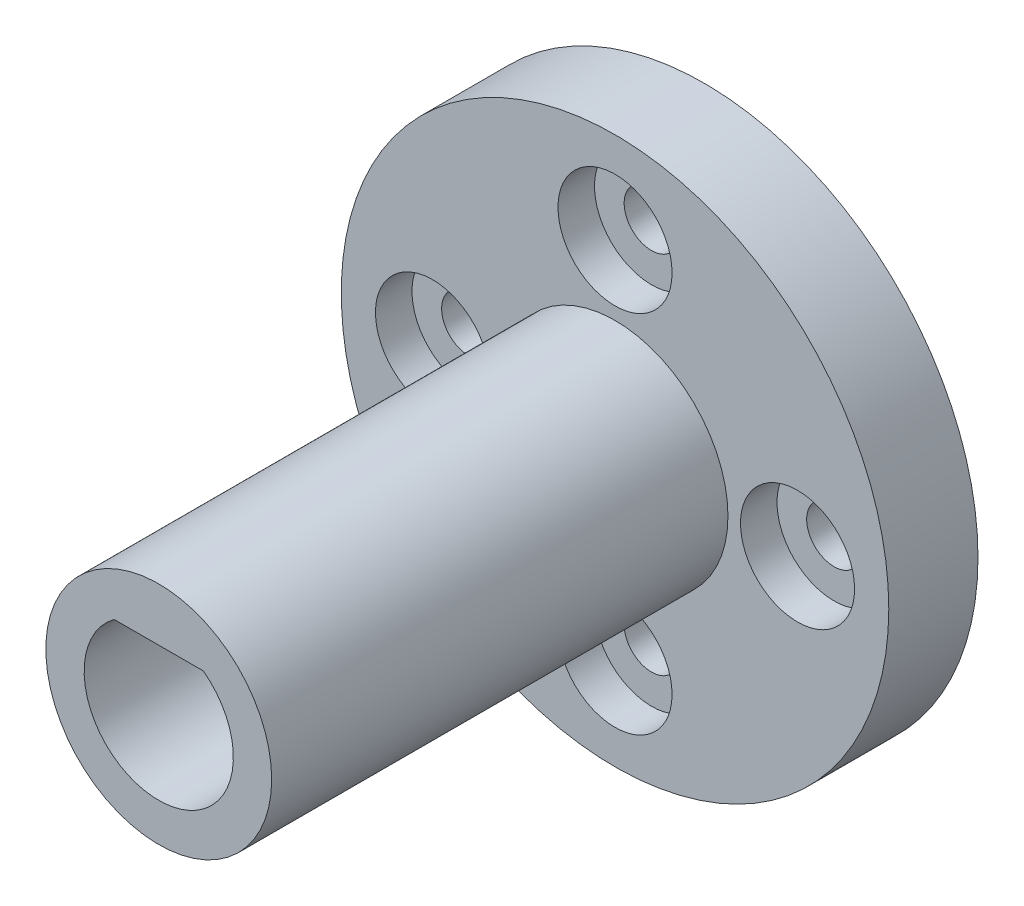
from build123d import *

# Parameters (mm, degrees)
ESQUISSE1_R                                        = 12
BOSS_EXTRU_1_DEPTH                                 = 3.91
ESQUISSE6_R                                        = 4.125
ENL_V_MAT_EXTRU_2_DEPTH                            = 2
BOSS_EXTRU_2_DEPTH                                 = 20
CHAMBRAGE_POUR_VIS_T_TE_RONDE_BOMB_E_M_D           = 2.4
CHAMBRAGE_POUR_VIS_T_TE_RONDE_BOMB_E_M_CBORE_D     = 5
CHAMBRAGE_POUR_VIS_T_TE_RONDE_BOMB_E_M_CBORE_DEPTH = 1.6
R_P_TITION_CIRCULAIRE2_COUNT                       = 4


with BuildPart() as part:
    # Esquisse1 → Boss.-Extru.1 (new body)
    with BuildSketch(Plane.XY):
        Circle(ESQUISSE1_R)
    extrude(amount=BOSS_EXTRU_1_DEPTH)

    # Esquisse6 → Enlèv. mat.-Extru.2 (cut)
    with BuildSketch(Plane(origin=(0, 0, 0), x_dir=(-1, 0, 0), z_dir=(0, 0, -1))):
        Circle(ESQUISSE6_R)
    extrude(amount=-ENL_V_MAT_EXTRU_2_DEPTH, mode=Mode.SUBTRACT)

    # Esquisse7 → Boss.-Extru.2 (add)
    # profile 1 of 2: a face of its own
    with BuildSketch(Plane.XY.offset(3.91)):
        with BuildLine():
            Line((-3.716127016, -3.27), (0, -3.27))
            Line((0, -3.27), (3.716127016, -3.27))
            ThreePointArc((3.716127016, -3.27), (4.631270276, -1.747522714), (4.95, 0))
            ThreePointArc((4.95, 0), (-1.747522714, 4.631270276), (-3.716127016, -3.27))
        make_face()
        with BuildLine():
            Line((-1.956655309, 2.62), (1.956655309, 2.62))
            ThreePointArc((1.956655309, 2.62), (3.103248298, -1.030897667), (0, -3.27))
            ThreePointArc((0, -3.27), (-3.103248298, -1.030897667), (-1.956655309, 2.62))
        make_face(mode=Mode.SUBTRACT)
    # profile 2 of 2: a face of its own
    with BuildSketch(Plane.XY.offset(3.91)):
        with BuildLine():
            Line((3.716127016, -3.27), (0, -3.27))
            Line((0, -3.27), (-3.716127016, -3.27))
            ThreePointArc((-3.716127016, -3.27), (0, -4.95), (3.716127016, -3.27))
        make_face()
    extrude(amount=BOSS_EXTRU_2_DEPTH)

    # Chambrage pour vis à tête ronde bombée M21 (through all)
    with Locations(Plane.XY.offset(3.91)):
        with Locations((0, 8)):
            chambrage_pour_vis_t_te_ronde_bomb_e_m = CounterBoreHole(CHAMBRAGE_POUR_VIS_T_TE_RONDE_BOMB_E_M_D / 2, CHAMBRAGE_POUR_VIS_T_TE_RONDE_BOMB_E_M_CBORE_D / 2, CHAMBRAGE_POUR_VIS_T_TE_RONDE_BOMB_E_M_CBORE_DEPTH)

    # Répétition circulaire2: Chambrage pour vis à tête ronde bombée M21 ×4 about axis
    r_p_tition_circulaire2_axis = Axis((0, 0, 0), (0, 0, 1))
    for i in range(1, R_P_TITION_CIRCULAIRE2_COUNT):
        add(chambrage_pour_vis_t_te_ronde_bomb_e_m.rotate(r_p_tition_circulaire2_axis, i * 360 / R_P_TITION_CIRCULAIRE2_COUNT), mode=Mode.SUBTRACT)


solid = part.part
